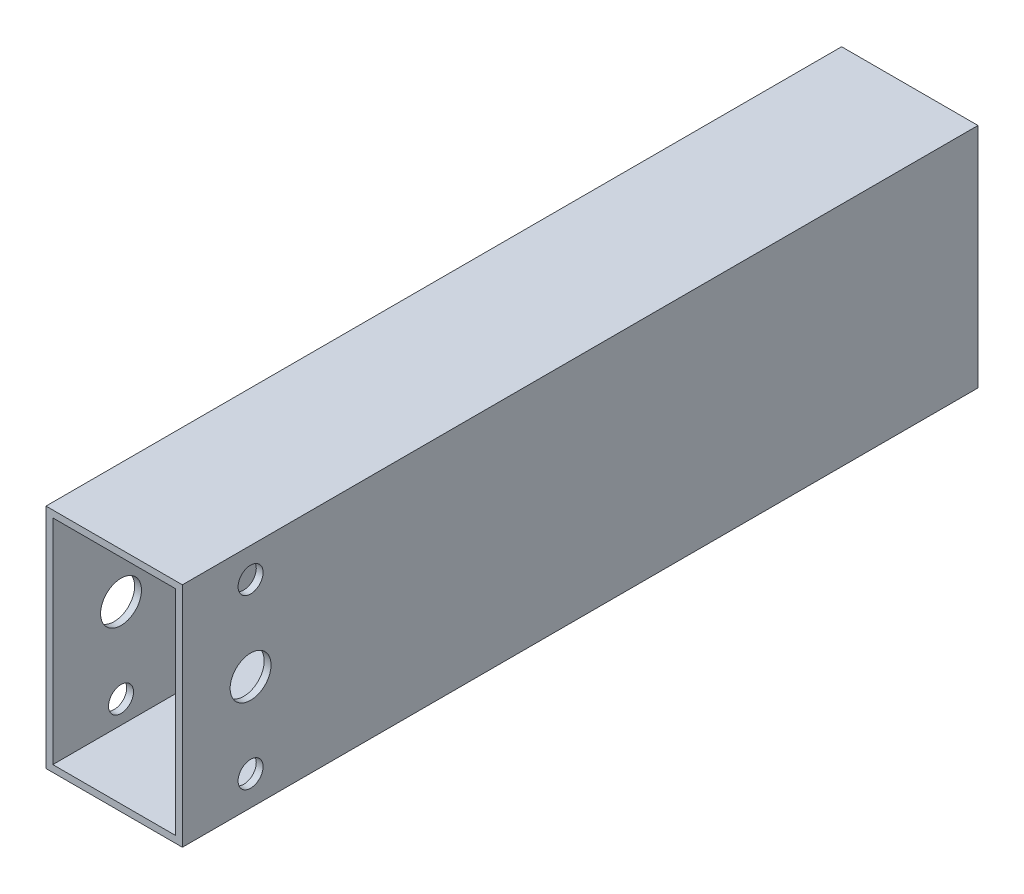
from build123d import *

# Parameters (mm, degrees)
ESBO_O1_W                   = 30
ESBO_O1_H                   = 50
ESBO_O1_W_2                 = 27
ESBO_O1_H_2                 = 47
RESSALTO_EXTRUS_O1_DEPTH    = 175
FURO_COM_FOLGA_DE_M53_D     = 5.5
FURO_COM_FOLGA_DE_M53_DEPTH = 30
FURO_COM_FOLGA_DE_M53_TIP   = 1.652366702
FURO_COM_FOLGA_DE_M85_D     = 9
FURO_COM_FOLGA_DE_M85_DEPTH = 30
FURO_COM_FOLGA_DE_M85_TIP   = 2.703872786


with BuildPart() as part:
    # Esboço1 → Ressalto-extrusão1 (new body)
    with BuildSketch(Plane.XY):
        with Locations((15, 25)):
            Rectangle(ESBO_O1_W, ESBO_O1_H)
        with Locations((15, 25)):
            Rectangle(ESBO_O1_W_2, ESBO_O1_H_2, mode=Mode.SUBTRACT)
    extrude(amount=RESSALTO_EXTRUS_O1_DEPTH)

    # Furo com folga de M53
    with Locations(Plane(origin=(30, 0, 0), x_dir=(0, 0, -1), z_dir=(1, 0, 0))):
        with Locations((-160, 43.5), (-160, 6.5)):
            Hole(FURO_COM_FOLGA_DE_M53_D / 2, depth=FURO_COM_FOLGA_DE_M53_DEPTH)
            with Locations((0, 0, -(FURO_COM_FOLGA_DE_M53_DEPTH + FURO_COM_FOLGA_DE_M53_TIP / 2))):  # 118° drill point
                Cone(0, FURO_COM_FOLGA_DE_M53_D / 2, FURO_COM_FOLGA_DE_M53_TIP, mode=Mode.SUBTRACT)

    # Furo com folga de M85
    with Locations(Plane(origin=(30, 0, 0), x_dir=(0, 0, -1), z_dir=(1, 0, 0))):
        with Locations((-160, 25)):
            Hole(FURO_COM_FOLGA_DE_M85_D / 2, depth=FURO_COM_FOLGA_DE_M85_DEPTH)
            with Locations((0, 0, -(FURO_COM_FOLGA_DE_M85_DEPTH + FURO_COM_FOLGA_DE_M85_TIP / 2))):  # 118° drill point
                Cone(0, FURO_COM_FOLGA_DE_M85_D / 2, FURO_COM_FOLGA_DE_M85_TIP, mode=Mode.SUBTRACT)


solid = part.part
